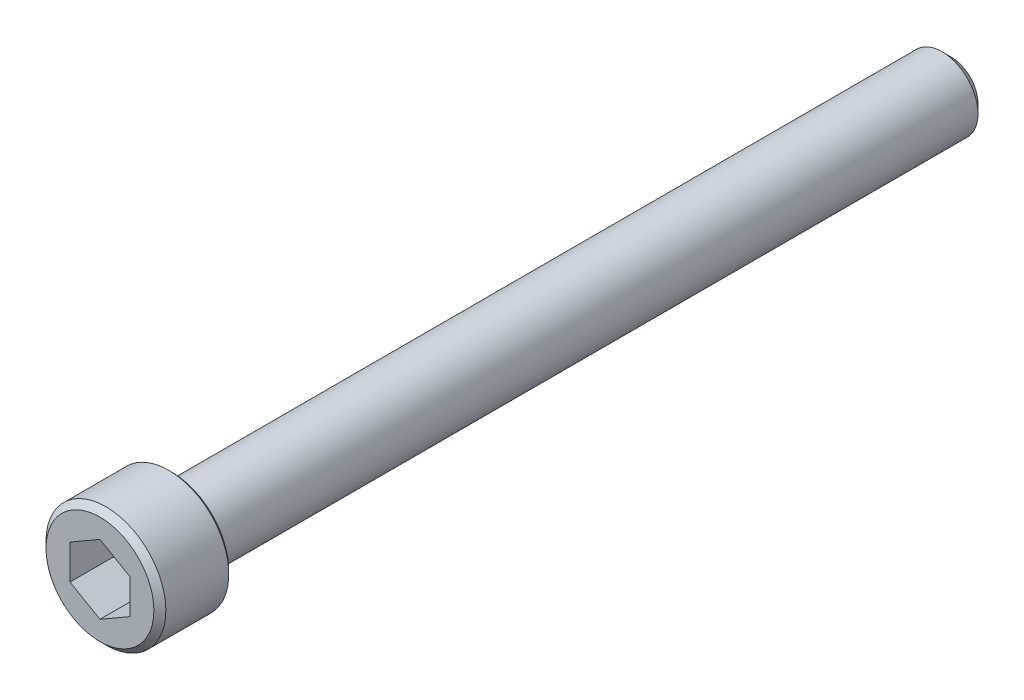
from build123d import *

# Parameters (mm, degrees)
CUT_EXTRUDE1_DEPTH = 3.75
CHAMFER1_SIZE      = 0.5
CHAMFER2_SIZE      = 0.25
CHAMFER3_SIZE      = 0.75


with BuildPart() as part:
    # Sketch2 → Revolve1 (revolve)
    with BuildSketch(Plane(origin=(0, 0, 0), x_dir=(0, 0, -1), z_dir=(1, 0, 0))):
        Polygon((-35.5, 5), (-29.5, 5), (-29.5, 3), (35.5, 3), (35.5, 0), (-35.5, 0), align=None)
    revolve(axis=Axis((0, 0, -35.5), (0, 0, 1)))

    # Sketch4 → Cut-Extrude1 (cut)
    with BuildSketch(Plane.XY.offset(35.5)):
        Polygon((0, 2.886751346), (-2.5, 1.443375673), (-2.5, -1.443375673), (0, -2.886751346), (2.5, -1.443375673), (2.5, 1.443375673), align=None)
    extrude(amount=-CUT_EXTRUDE1_DEPTH, mode=Mode.SUBTRACT)

    # Chamfer1
    chamfer1_edges = [part.edges().sort_by_distance(p)[0] for p in [
        (0, -5, 35.5),
    ]]
    chamfer(chamfer1_edges, length=CHAMFER1_SIZE)

    # Chamfer2
    chamfer2_edges = [part.edges().sort_by_distance(p)[0] for p in [
        (0, -5, 29.5),
    ]]
    chamfer(chamfer2_edges, length=CHAMFER2_SIZE)

    # Chamfer3
    chamfer3_edges = [part.edges().sort_by_distance(p)[0] for p in [
        (0, -3, -35.5),
    ]]
    chamfer(chamfer3_edges, length=CHAMFER3_SIZE)


solid = part.part
